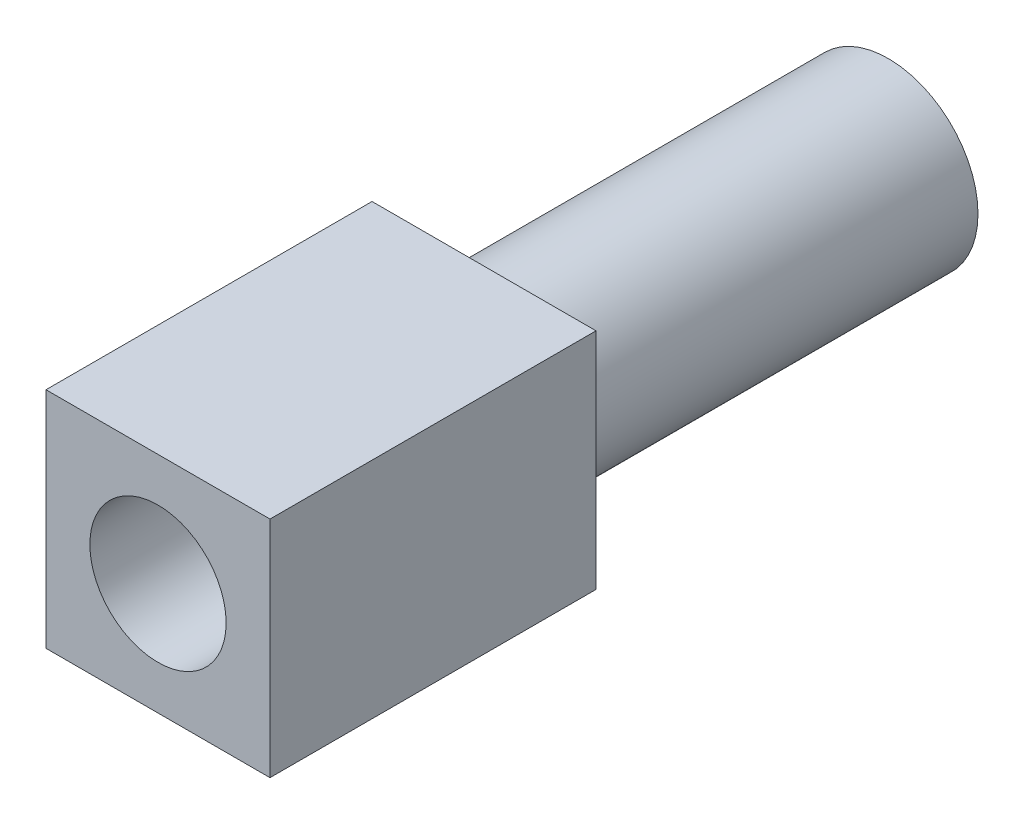
from build123d import *

# Parameters (mm, degrees)
ESQUISSE1_W             = 13.74
ESQUISSE1_H             = 13.74
BOSS_EXTRU_1_DEPTH      = 20
ESQUISSE3_R             = 4.18
ENL_V_MAT_EXTRU_2_DEPTH = 10
ESQUISSE2_R             = 2.49
BOSS_EXTRU_4_DEPTH      = 24.8
ENL_V_START             = -24.8
ENL_V_MAT_EXTRU_4_DEPTH = 24.8
ESQUISSE6_R             = 5.5
ESQUISSE6_R_2           = 2.49
BOSS_EXTRU_5_DEPTH      = 24.8


with BuildPart() as part:
    # Esquisse1 → Boss.-Extru.1 (new body)
    with BuildSketch(Plane.XY):
        with Locations((-30.186071131, 8.6104)):
            Rectangle(ESQUISSE1_W, ESQUISSE1_H)
    extrude(amount=BOSS_EXTRU_1_DEPTH)

    # Esquisse3 → Enlèv. mat.-Extru.2 (cut)
    with BuildSketch(Plane.XY.offset(20)):
        with Locations((-30.186071131, 8.6104)):
            Circle(ESQUISSE3_R)
    extrude(amount=-ENL_V_MAT_EXTRU_2_DEPTH, mode=Mode.SUBTRACT)

    # Esquisse2 → Boss.-Extru.4 (add)
    with BuildSketch(Plane(origin=(0, 0, 0), x_dir=(-1, 0, 0), z_dir=(0, 0, -1))):
        with Locations(Location((30.186071131, 8.6104, 0), (0, 0, 180))):
            Circle(ESQUISSE2_R)
    extrude(amount=BOSS_EXTRU_4_DEPTH)

    # Esquisse5 → Enlèv. mat.-Extru.4 (cut)
    with BuildSketch(Plane(origin=(0, 0, -24.8), x_dir=(-1, 0, 0), z_dir=(0, 0, -1)).offset(ENL_V_START)):
        with BuildLine():
            Line((27.696071131, 8.6104), (29.625790006, 11.036546134))
            ThreePointArc((29.625790006, 11.036546134), (32.134814315, 7.0604), (27.696071131, 8.6104))
        make_face()
    extrude(amount=ENL_V_MAT_EXTRU_4_DEPTH, mode=Mode.SUBTRACT)

    # Esquisse6 → Boss.-Extru.5 (add)
    with BuildSketch(Plane(origin=(0, 0, 0), x_dir=(-1, 0, 0), z_dir=(0, 0, -1))):
        with Locations(Location((30.186071131, 8.6104, 0), (0, 0, 180))):
            Circle(ESQUISSE6_R)
        with Locations((30.186071131, 8.6104)):
            Circle(ESQUISSE6_R_2, mode=Mode.SUBTRACT)
    extrude(amount=BOSS_EXTRU_5_DEPTH)


solid = part.part
